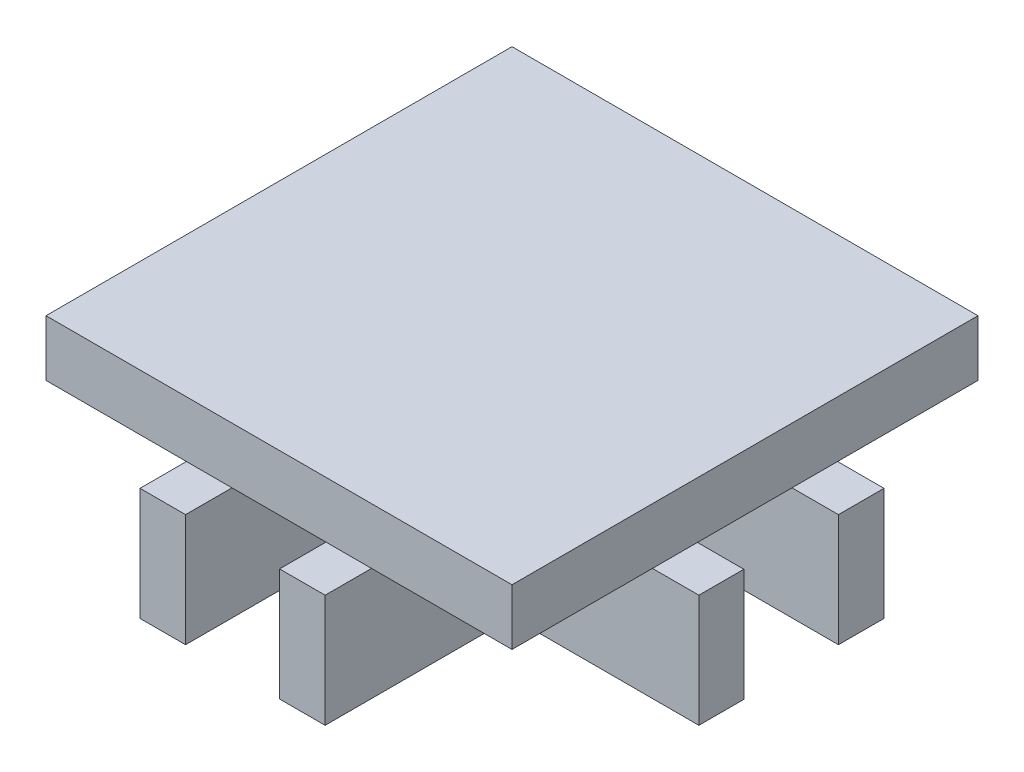
from build123d import *

# Parameters (mm, degrees)
SKETCH1_W           = 79.8
SKETCH1_H           = 79.8
BOSS_EXTRUDE1_DEPTH = 9.6
SKETCH3_W           = 93.857769302
SKETCH3_H           = 7.7
SKETCH3_W_2         = 31.7
SKETCH3_H_2         = 31.7
SKETCH3_W_3         = 95.7
SKETCH3_H_3         = 7.8
SKETCH3_W_4         = 7.8
SKETCH3_H_4         = 95.7
BOSS_EXTRUDE2_DEPTH = 19.3


with BuildPart() as part:
    # Sketch1 → Boss-Extrude1 (new body)
    with BuildSketch(Plane(origin=(0, 0, 0), x_dir=(1, 0, 0), z_dir=(0, 1, 0))):
        with Locations((-0.532, -4.965333333)):
            Rectangle(SKETCH1_W, SKETCH1_H)
    extrude(amount=BOSS_EXTRUDE1_DEPTH)

    # Sketch3 → Boss-Extrude2 (add)
    with BuildSketch(Plane.XZ):
        with Locations((0.389115349, 16.965333333)):
            Rectangle(SKETCH3_W, SKETCH3_H)
        with Locations((-0.532, 4.965333333)):
            Rectangle(SKETCH3_W_2, SKETCH3_H_2)
        with Locations((-0.532, -6.984666667)):
            Rectangle(SKETCH3_W_3, SKETCH3_H_3)
        with Locations((-12.482, 4.965333333)):
            Rectangle(SKETCH3_W_4, SKETCH3_H_4)
        with Locations((11.418, 4.965333333)):
            Rectangle(SKETCH3_W_4, SKETCH3_H_4)
    extrude(amount=BOSS_EXTRUDE2_DEPTH)


solid = part.part
